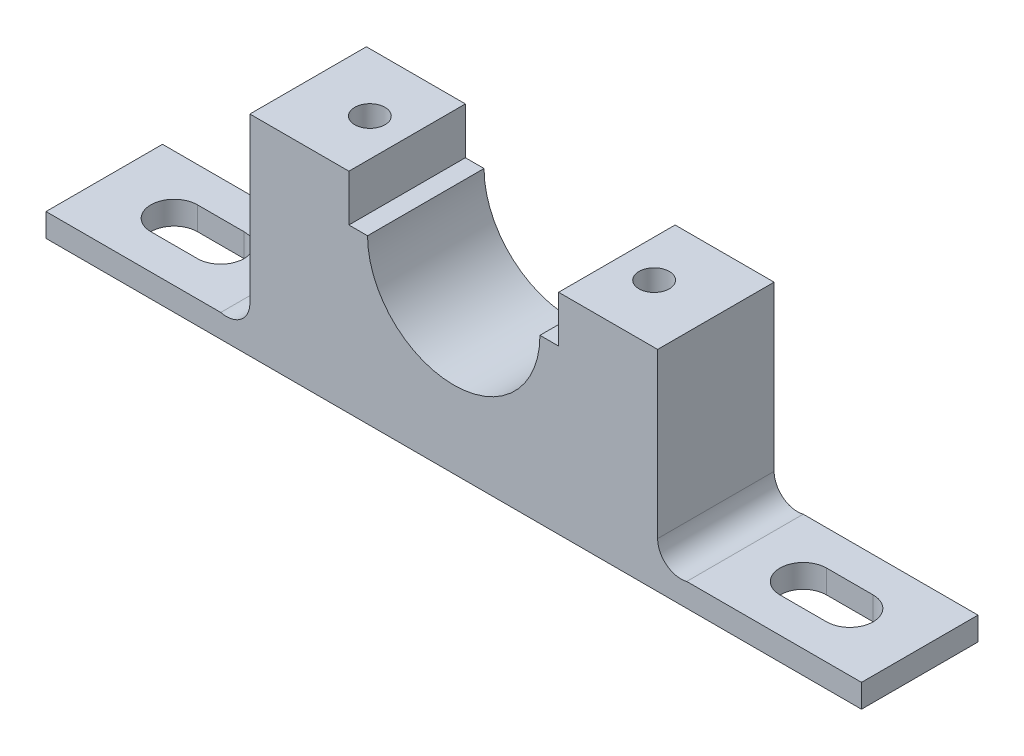
from build123d import *

# Parameters (mm, degrees)
BOSS_EXTRUDE2_DEPTH      = 12.5
BOSS_EXTRUDE2_DEPTH_BACK = 12.5
SKETCH2_R                = 3.25
CUT_EXTRUDE3_DEPTH       = 45


with BuildPart() as part:
    # Sketch1 → Boss-Extrude2 (new, two sides: drawn at the far end of the back side and taken through both)
    with BuildSketch(Plane.XY.offset(-BOSS_EXTRUDE2_DEPTH_BACK)):
        with BuildLine():
            Line((87.5, 0), (-87.5, 0))
            Line((-87.5, 0), (-87.5, 5))
            Line((-87.5, 5), (-49.996574748, 5))
            ThreePointArc((-49.996574748, 5), (-45.686739788, 5.89034852), (-43.75, 9.842112287))
            Line((-43.75, 9.842112287), (-43.75, 45))
            Line((-43.75, 45), (-22.5, 45))
            Line((-22.5, 45), (-22.5, 35))
            Line((-22.5, 35), (-18.5, 35))
            ThreePointArc((-18.5, 35), (0, 16.5), (18.5, 35))
            Line((18.5, 35), (22.5, 35))
            Line((22.5, 35), (22.5, 45))
            Line((22.5, 45), (43.75, 45))
            Line((43.75, 45), (43.75, 9.842112287))
            ThreePointArc((43.75, 9.842112287), (45.686739788, 5.89034852), (49.996574748, 5))
            Line((49.996574748, 5), (87.5, 5))
            Line((87.5, 5), (87.5, 0))
        make_face()
    extrude(amount=BOSS_EXTRUDE2_DEPTH + BOSS_EXTRUDE2_DEPTH_BACK)

    # Sketch2 → Cut-Extrude3 (cut)
    with BuildSketch(Plane(origin=(0, 0, 0), x_dir=(1, 0, 0), z_dir=(0, 1, 0))):
        with Locations((-30.5, 0)):
            Circle(SKETCH2_R)
        with Locations((30.5, 0)):
            Circle(SKETCH2_R)
        with BuildLine():
            Line((-72.502650664, 5), (-62.502650664, 5))
            ThreePointArc((-62.502650664, 5), (-57.502650664, 0), (-62.502650664, -5))
            Line((-62.502650664, -5), (-72.502650664, -5))
            ThreePointArc((-72.502650664, -5), (-77.502650664, 0), (-72.502650664, 5))
        make_face()
        with BuildLine():
            Line((72.502650664, -5), (62.502650664, -5))
            ThreePointArc((62.502650664, -5), (57.502650664, 0), (62.502650664, 5))
            Line((62.502650664, 5), (72.502650664, 5))
            ThreePointArc((72.502650664, 5), (77.502650664, 0), (72.502650664, -5))
        make_face()
    extrude(amount=CUT_EXTRUDE3_DEPTH, mode=Mode.SUBTRACT)


solid = part.part
